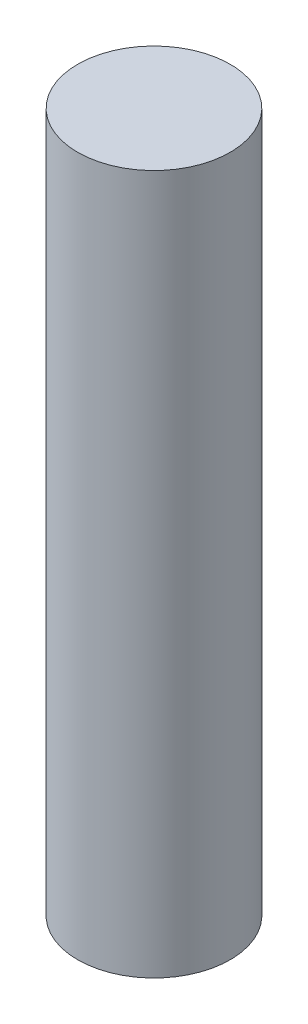
from build123d import *

# Parameters (mm, degrees)
SKETCH1_R           = 3
BOSS_EXTRUDE2_DEPTH = 27.5


with BuildPart() as part:
    # Sketch1 → Boss-Extrude2 (new body)
    with BuildSketch(Plane(origin=(0, 0, 0), x_dir=(1, 0, 0), z_dir=(0, 1, 0))):
        with Locations(Location((0, 0, 0), (0, 0, 270))):
            Circle(SKETCH1_R)
    extrude(amount=BOSS_EXTRUDE2_DEPTH)


solid = part.part
